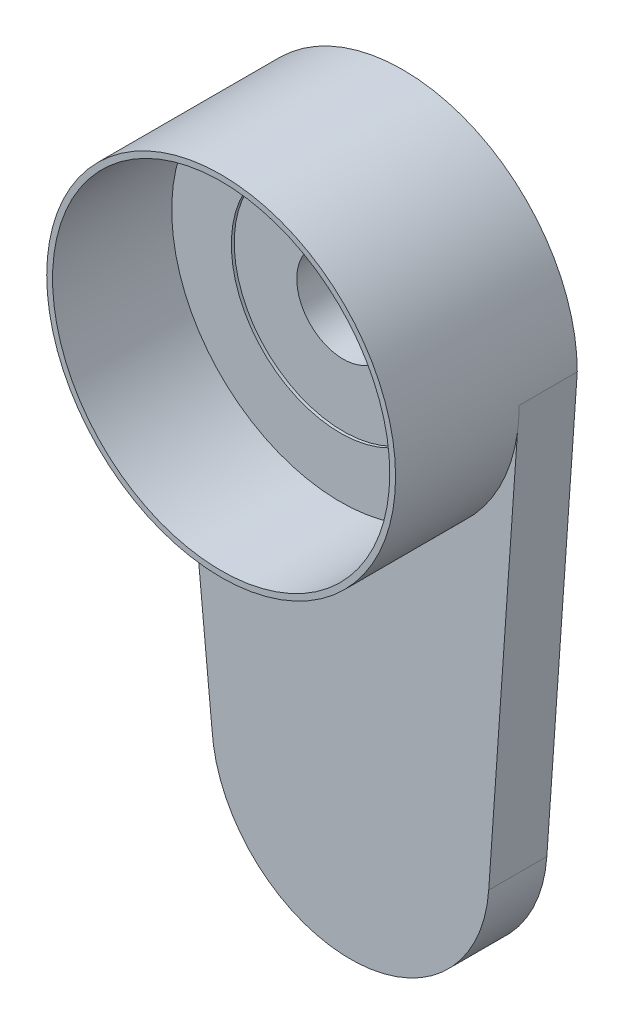
from build123d import *
from build123d.topology import SkipClean

# Parameters (mm, degrees)
SKETCH2_R               = 120
BOSS_EXTRUDE2_DEPTH     = 85
SKETCH3_R               = 116
CUT_EXTRUDE1_DEPTH      = 82
CUT_EXTRUDE5_DEPTH      = 2
CUT_EXTRUDE5_DEPTH_BACK = 2
SKETCH8_R               = 75
SKETCH9_R               = 32
CUT_EXTRUDE6_DEPTH      = 5
BOSS_EXTRUDE4_START     = 40
SKETCH12_R              = 32
BOSS_EXTRUDE4_DEPTH     = 40


with BuildPart() as part:
    # Sketch2 → Boss-Extrude2 (new body)
    with BuildSketch(Plane.XY):
        Circle(SKETCH2_R)
    extrude(amount=BOSS_EXTRUDE2_DEPTH)

    # Sketch3 → Cut-Extrude1 (cut)
    with BuildSketch(Plane.XY.offset(85)):
        Circle(SKETCH3_R)
    extrude(amount=-CUT_EXTRUDE1_DEPTH, mode=Mode.SUBTRACT)

    # Sketch8 → Cut-Extrude5 (cut, two sides: drawn at the far end of the back side and taken through both)
    with BuildSketch(Plane.XY.offset(3).offset(-CUT_EXTRUDE5_DEPTH_BACK)):
        Circle(SKETCH8_R)
    extrude(amount=CUT_EXTRUDE5_DEPTH + CUT_EXTRUDE5_DEPTH_BACK, mode=Mode.SUBTRACT)

    # Sketch9 → Cut-Extrude6 (cut)
    with BuildSketch(Plane.XY.offset(1)):
        Circle(SKETCH9_R)
    extrude(amount=-CUT_EXTRUDE6_DEPTH, mode=Mode.SUBTRACT)

    # Sketch12 → Boss-Extrude4 (add)
    # profile 1 of 2: a face of its own
    with SkipClean():  # the faces are left unmerged after this step: merging them gives an invalid solid
        with BuildSketch(Plane(origin=(0, 0, 0), x_dir=(-1, 0, 0), z_dir=(0, 0, -1)).offset(BOSS_EXTRUDE4_START)):
            with BuildLine():
                ThreePointArc((120, 0), (0, 120), (-120, 0))
                Line((-120, 0), (-118.831087629, -16.70845932))
                ThreePointArc((-118.831087629, -16.70845932), (-3.111785776, -119.959646504), (117.805011812, -22.84686394))
                Line((117.805011812, -22.84686394), (120, 0))
            make_face()
            with Locations(Location((0, 0, 0), (0, 0, 180))):
                Circle(SKETCH12_R, mode=Mode.SUBTRACT)
        # profile 2 of 2: a face of its own
        with BuildSketch(Plane(origin=(0, 0, 0), x_dir=(-1, 0, 0), z_dir=(0, 0, -1)).offset(BOSS_EXTRUDE4_START)):
            with BuildLine():
                ThreePointArc((117.805011812, -22.84686394), (-3.111785776, -119.959646504), (-118.831087629, -16.70845932))
                Line((-118.831087629, -16.70845932), (-99.063378042, -299.268538041))
                ThreePointArc((-99.063378042, -299.268538041), (-3.575656086, -388.008129656), (91.309922092, -298.624981255))
                Line((91.309922092, -298.624981255), (117.805011812, -22.84686394))
            make_face()
        extrude(amount=-BOSS_EXTRUDE4_DEPTH)


solid = part.part
